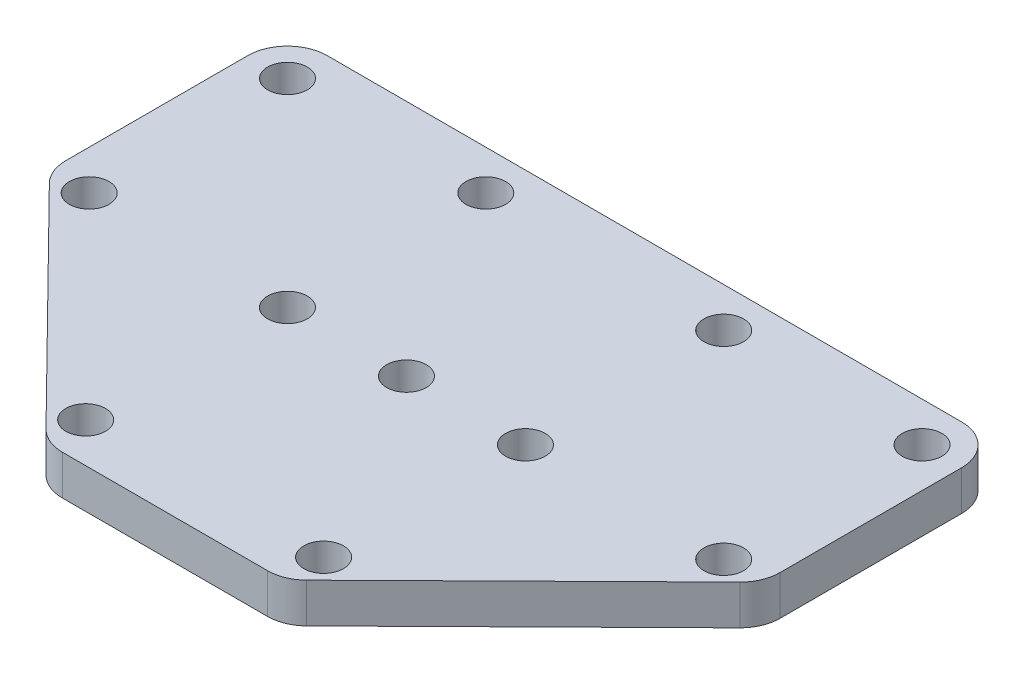
from build123d import *

# Parameters (mm, degrees)
BOSS_EXTRUDE1_DEPTH = 12.7
SKETCH2_R           = 6.35
CUT_EXTRUDE1_DEPTH  = 182.323455578


with BuildPart() as part:
    # Sketch1 → Boss-Extrude1 (new body)
    with BuildSketch(Plane(origin=(0, 0, 0), x_dir=(1, 0, 0), z_dir=(0, 1, 0))):
        with BuildLine():
            Line((-131.471489953, 109.23134636), (71.728510047, 109.23134636))
            ThreePointArc((71.728510047, 109.23134636), (80.708766168, 105.511602481), (84.428510047, 96.53134636))
            Line((84.428510047, 96.53134636), (84.428510047, 38.349564826))
            ThreePointArc((84.428510047, 38.349564826), (83.442873319, 33.444088994), (80.638952072, 29.300033185))
            Line((80.638952072, 29.300033185), (10.746499625, -39.518185281))
            ThreePointArc((10.746499625, -39.518185281), (6.650668081, -42.220654573), (1.836057601, -43.16865364))
            Line((1.836057601, -43.16865364), (-63.841823784, -43.16865364))
            ThreePointArc((-63.841823784, -43.16865364), (-68.748013198, -42.182718068), (-72.892440933, -39.377993078))
            Line((-72.892440933, -39.377993078), (-140.522107103, 29.324094297))
            ThreePointArc((-140.522107103, 29.324094297), (-143.22378415, 33.419539146), (-144.171489953, 38.233433734))
            Line((-144.171489953, 38.233433734), (-144.171489953, 96.53134636))
            ThreePointArc((-144.171489953, 96.53134636), (-140.451746074, 105.511602481), (-131.471489953, 109.23134636))
        make_face()
    extrude(amount=BOSS_EXTRUDE1_DEPTH)

    # Sketch2 → Cut-Extrude1 (cut, through all)
    with BuildSketch(Plane(origin=(0, 12.7, 0), x_dir=(1, 0, 0), z_dir=(0, 1, 0))):
        with Locations(Location((-69.102883091, -30.46865364, 0), (0, 0, 270))):
            Circle(SKETCH2_R)
        with Locations(Location((7.097116909, -30.46865364, 0), (0, 0, 270))):
            Circle(SKETCH2_R)
        with Locations(Location((-67.971489953, 96.53134636, 0), (0, 0, 270))):
            Circle(SKETCH2_R)
        with Locations(Location((8.228510047, 96.53134636, 0), (0, 0, 270))):
            Circle(SKETCH2_R)
        with Locations(Location((-67.971489286, 33.021266411, 0), (0, 0, 270))):
            Circle(SKETCH2_R)
        with Locations(Location((8.228510047, 33.03134636, 0), (0, 0, 270))):
            Circle(SKETCH2_R)
        with Locations(Location((-131.471489953, 96.53134636, 0), (0, 0, 270))):
            Circle(SKETCH2_R)
        with Locations(Location((-131.471489953, 33.03134636, 0), (0, 0, 270))):
            Circle(SKETCH2_R)
        with Locations(Location((71.728510047, 96.53134636, 0), (0, 0, 270))):
            Circle(SKETCH2_R)
        with Locations(Location((71.728510047, 33.03134636, 0), (0, 0, 270))):
            Circle(SKETCH2_R)
        with Locations(Location((-29.871490619, 33.03134636, 0), (0, 0, 270))):
            Circle(SKETCH2_R)
    extrude(amount=-CUT_EXTRUDE1_DEPTH, mode=Mode.SUBTRACT)


solid = part.part
